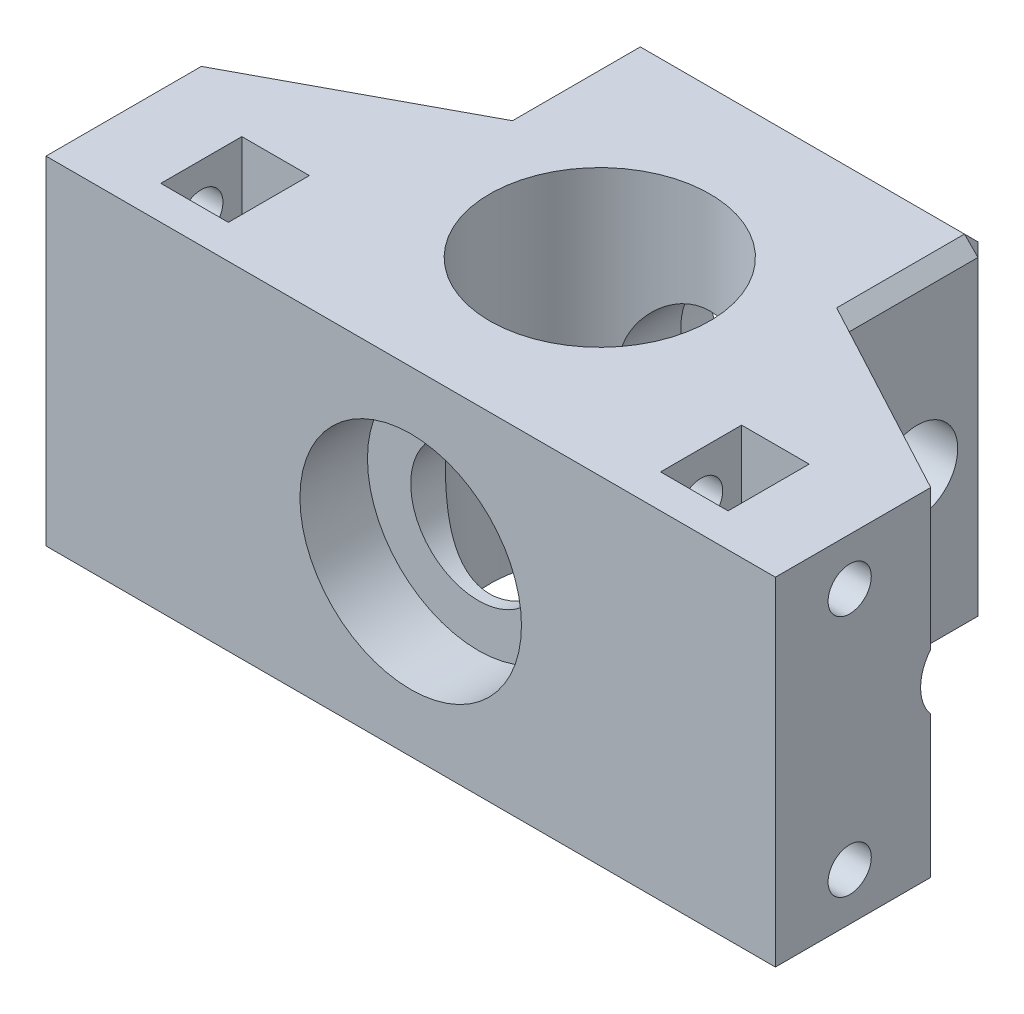
from build123d import *

# Parameters (mm, degrees)
SKETCH1_R               = 8.15
BOSS_EXTRUDE1_DEPTH     = 25
SKETCH2_R               = 5
CUT_EXTRUDE1_DEPTH      = 48.476309882
SKETCH3_R               = 8.2
CUT_EXTRUDE2_DEPTH      = 5
CUT_EXTRUDE3_START      = -5
SKETCH4_R               = 8.2
CUT_EXTRUDE3_DEPTH      = 5
CHAMFER1_SIZE           = 1
CUT_EXTRUDE4_DEPTH      = 41.124805358
CUT_EXTRUDE4_DEPTH_BACK = 41.124805358
SKETCH5_R               = 1.25
CUT_EXTRUDE5_START      = -13
SKETCH6_R               = 3.25
CUT_EXTRUDE5_DEPTH      = 28.124805358
SKETCH7_R               = 3
CUT_EXTRUDE6_DEPTH      = 4
SKETCH9_R               = 1.6
CUT_EXTRUDE7_DEPTH      = 14
CUT_EXTRUDE8_START      = -6
CUT_EXTRUDE8_DEPTH      = 5


with BuildPart() as part:
    # Sketch1 → Boss-Extrude1 (new body)
    with BuildSketch(Plane(origin=(0, 0, 0), x_dir=(1, 0, 0), z_dir=(0, 1, 0))):
        Polygon((-13, 14), (-13, 5), (-27, -2.5), (-27, -14), (27, -14), (27, -2.5), (13, 5), (13, 14), (13, 16), (-13, 16), align=None)
        with Locations(Location((0, 0, 0), (0, 0, 270))):
            Circle(SKETCH1_R, mode=Mode.SUBTRACT)
    extrude(amount=BOSS_EXTRUDE1_DEPTH)

    # Sketch2 → Cut-Extrude1 (cut, through all)
    with BuildSketch(Plane.XY.offset(14)):
        with Locations((0, 12.5)):
            Circle(SKETCH2_R)
    extrude(amount=-CUT_EXTRUDE1_DEPTH, mode=Mode.SUBTRACT)

    # Sketch3 → Cut-Extrude2 (cut)
    with BuildSketch(Plane(origin=(0, 0, -16), x_dir=(-1, 0, 0), z_dir=(0, 0, -1))):
        with Locations((0, 12.5)):
            Circle(SKETCH3_R)
    extrude(amount=-CUT_EXTRUDE2_DEPTH, mode=Mode.SUBTRACT)

    # Sketch4 → Cut-Extrude3 (cut)
    with BuildSketch(Plane.XY.offset(14).offset(CUT_EXTRUDE3_START)):
        with Locations(Location((0, 12.5, 0), (0, 0, 180))):
            Circle(SKETCH4_R)
    extrude(amount=CUT_EXTRUDE3_DEPTH, mode=Mode.SUBTRACT)

    # Chamfer1
    chamfer1_edges = [part.edges().sort_by_distance(p)[0] for p in [
        (-13, 0, -10.5),
        (-13, 12.5, -16),
        (13, 12.5, -16),
        (13, 25, -10.5),
        (0, 25, -16),
        (-13, 25, -10.5),
        (0, 0, -16),
        (13, 0, -10.5),
    ]]
    chamfer(chamfer1_edges, length=CHAMFER1_SIZE)

    # Sketch5 → Cut-Extrude4 (cut, two sides: drawn at the far end of the back side and taken through both)
    with BuildSketch(Plane(origin=(0, 0, 0), x_dir=(0, 0, -1), z_dir=(1, 0, 0)).offset(-CUT_EXTRUDE4_DEPTH_BACK)):
        with Locations((0, 12.546077806)):
            Circle(SKETCH5_R)
    extrude(amount=CUT_EXTRUDE4_DEPTH + CUT_EXTRUDE4_DEPTH_BACK, mode=Mode.SUBTRACT)

    # Sketch6 → Cut-Extrude5 (cut, through all)
    with BuildSketch(Plane(origin=(0, 0, 0), x_dir=(0, 0, -1), z_dir=(1, 0, 0)).offset(CUT_EXTRUDE5_START)):
        with Locations((0, 12.546077806)):
            Circle(SKETCH6_R)
    cut_extrude5 = extrude(amount=-CUT_EXTRUDE5_DEPTH, mode=Mode.SUBTRACT)

    # Mirror1: Cut-Extrude5 across plane
    add(cut_extrude5.mirror(Plane(origin=(0, 0, 0), x_dir=(0, 0, 1), z_dir=(1, 0, 0))), mode=Mode.SUBTRACT)

    # Sketch7 → Cut-Extrude6 (cut)
    with BuildSketch(Plane(origin=(13, 0, 0), x_dir=(0, 0, -1), z_dir=(1, 0, 0))):
        with Locations((10.5, 12.5)):
            Circle(SKETCH7_R)
    cut_extrude6 = extrude(amount=-CUT_EXTRUDE6_DEPTH, mode=Mode.SUBTRACT)

    # Sketch9 → Cut-Extrude7 (cut)
    with BuildSketch(Plane(origin=(27, 0, 0), x_dir=(0, 0, -1), z_dir=(1, 0, 0))):
        with Locations((-8.5, 21.5)):
            Circle(SKETCH9_R)
        with Locations((-8.5, 3.5)):
            Circle(SKETCH9_R)
    cut_extrude7 = extrude(amount=-CUT_EXTRUDE7_DEPTH, mode=Mode.SUBTRACT)

    # Sketch10 → Cut-Extrude8 (cut)
    with BuildSketch(Plane(origin=(27, 0, 0), x_dir=(0, 0, -1), z_dir=(1, 0, 0)).offset(CUT_EXTRUDE8_START)):
        Polygon((-11.5, 19.767949192), (-11.5, 18.767949192), (-8.5, 17.035898385), (-5.5, 18.767949192), (-5.5, 19.767949192), (-5.5, 23.232050808), (-5.5, 25), (-11.5, 25), (-11.5, 23.232050808), align=None)
        Polygon((-11.5, 0), (-11.5, 1.767949192), (-11.5, 5.232050808), (-11.5, 6.232050808), (-8.5, 7.964101615), (-5.5, 6.232050808), (-5.5, 5.232050808), (-5.5, 1.767949192), (-5.5, 0), align=None)
    cut_extrude8 = extrude(amount=-CUT_EXTRUDE8_DEPTH, mode=Mode.SUBTRACT)

    # Mirror2: Cut-Extrude6, Cut-Extrude7, Cut-Extrude8 across plane
    add(cut_extrude6.mirror(Plane(origin=(0, 0, 0), x_dir=(0, 0, 1), z_dir=(1, 0, 0))), mode=Mode.SUBTRACT)
    add(cut_extrude7.mirror(Plane(origin=(0, 0, 0), x_dir=(0, 0, 1), z_dir=(1, 0, 0))), mode=Mode.SUBTRACT)
    add(cut_extrude8.mirror(Plane(origin=(0, 0, 0), x_dir=(0, 0, 1), z_dir=(1, 0, 0))), mode=Mode.SUBTRACT)


solid = part.part
